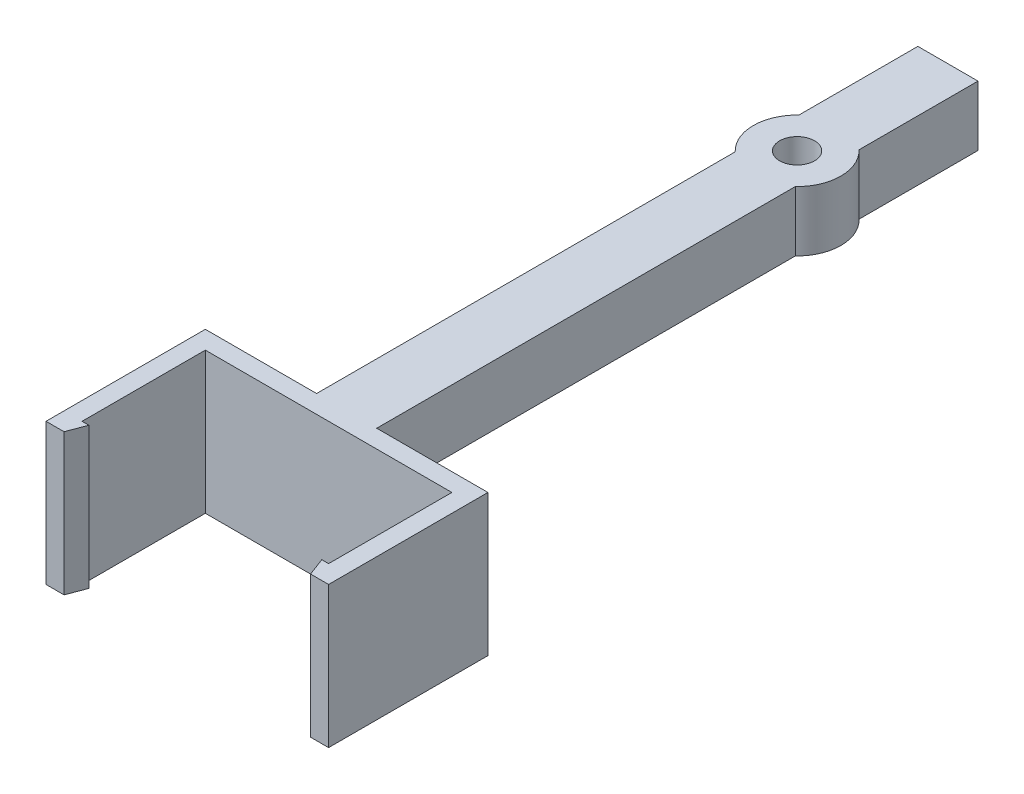
from build123d import *

# Parameters (mm, degrees)
SKETCH1_W           = 47
SKETCH1_H           = 26.5
SKETCH1_W_2         = 41
SKETCH1_H_2         = 20.5
BOSS_EXTRUDE1_DEPTH = 31
CUT_EXTRUDE2_DEPTH  = 31
SKETCH4_W           = 10
SKETCH4_H           = 10
BOSS_EXTRUDE3_DEPTH = 100
SKETCH7_R           = 2.9
CUT_EXTRUDE5_DEPTH  = 100
SKETCH8_R           = 7.284546015
SKETCH8_R_2         = 2.9
BOSS_EXTRUDE4_DEPTH = 10
SKETCH10_W          = 26.5
SKETCH10_H          = 7.496145738
CUT_EXTRUDE6_DEPTH  = 105


with BuildPart() as part:
    # Sketch1 → Boss-Extrude1 (new body)
    with BuildSketch(Plane(origin=(0, 0, 0), x_dir=(1, 0, 0), z_dir=(0, 1, 0))):
        Rectangle(SKETCH1_W, SKETCH1_H)
        Rectangle(SKETCH1_W_2, SKETCH1_H_2, mode=Mode.SUBTRACT)
    extrude(amount=BOSS_EXTRUDE1_DEPTH)

    # Sketch3 → Cut-Extrude2 (cut)
    with BuildSketch(Plane(origin=(0, 31, 0), x_dir=(1, 0, 0), z_dir=(0, 1, 0))):
        Polygon((-19.366144394, -10.25), (-20.5, -13.25), (0, -13.25), (0, -10.25), align=None)
        Polygon((0, -10.25), (0, -13.25), (20.5, -13.25), (19.366144394, -10.25), align=None)
    extrude(amount=-CUT_EXTRUDE2_DEPTH, mode=Mode.SUBTRACT)

    # Sketch4 → Boss-Extrude3 (add)
    with BuildSketch(Plane(origin=(0, 0, -13.25), x_dir=(-1, 0, 0), z_dir=(0, 0, -1))):
        with Locations((0, 26)):
            Rectangle(SKETCH4_W, SKETCH4_H)
    extrude(amount=BOSS_EXTRUDE3_DEPTH)

    # Sketch7 → Cut-Extrude5 (cut)
    with BuildSketch(Plane.XZ.offset(-21)):
        with Locations(Location((0, -88.166602936, 0), (0, 0, 270))):
            Circle(SKETCH7_R)
    extrude(amount=-CUT_EXTRUDE5_DEPTH, mode=Mode.SUBTRACT)

    # Sketch8 → Boss-Extrude4 (add)
    with BuildSketch(Plane(origin=(0, 21, 0), x_dir=(-1, 0, 0), z_dir=(0, -1, 0))):
        with Locations((0, 88.166602936)):
            Circle(SKETCH8_R)
        with Locations(Location((0, 88.166602936, 0), (0, 0, 90))):
            Circle(SKETCH8_R_2, mode=Mode.SUBTRACT)
    extrude(amount=-BOSS_EXTRUDE4_DEPTH)

    # Sketch10 → Cut-Extrude6 (cut)
    with BuildSketch(Plane.ZY.offset(23.5)):
        with Locations((0, 3.748072869)):
            Rectangle(SKETCH10_W, SKETCH10_H)
    extrude(amount=-CUT_EXTRUDE6_DEPTH, mode=Mode.SUBTRACT)


solid = part.part
